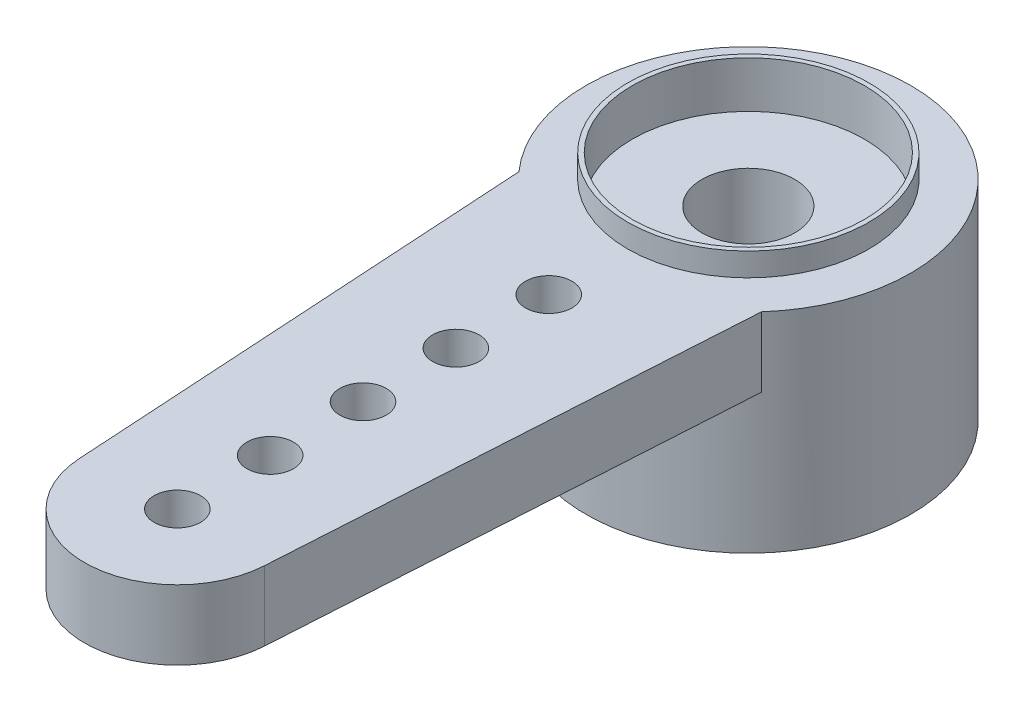
from build123d import *

# Parameters (mm, degrees)
SKETCH1_R           = 0.5
SKETCH1_R_2         = 1
BOSS_EXTRUDE1_DEPTH = 0.75
SKETCH2_R           = 3.5
SKETCH2_R_2         = 2.375
BOSS_EXTRUDE2_DEPTH = 3
SKETCH4_R           = 2.6
SKETCH4_R_2         = 2.5
EXTRUDE_THIN1_DEPTH = 0.5
CUT_EXTRUDE1_START  = -0.5
SKETCH5_R           = 2.5
CUT_EXTRUDE1_DEPTH  = 0.5
MOVE_FACE1_BY       = 0.5


with BuildPart() as part:
    # Sketch1 → Boss-Extrude1 (new, symmetric)
    with BuildSketch(Plane(origin=(0, 0, 0), x_dir=(1, 0, 0), z_dir=(0, 1, 0))):
        with BuildLine():
            Line((-2.612867, -2.328718), (-1.996279, -12.421951))
            ThreePointArc((-1.996279, -12.421951), (0, -14.3), (1.996279, -12.421951))
            Line((1.996279, -12.421951), (2.612867, -2.328718))
            ThreePointArc((2.612867, -2.328718), (0, 3.5), (-2.612867, -2.328718))
        make_face()
        with Locations(Location((0, -12.3, 0), (0, 0, 270))):
            Circle(SKETCH1_R, mode=Mode.SUBTRACT)
        with Locations(Location((0, -10.3, 0), (0, 0, 270))):
            Circle(SKETCH1_R, mode=Mode.SUBTRACT)
        with Locations(Location((0, -8.3, 0), (0, 0, 270))):
            Circle(SKETCH1_R, mode=Mode.SUBTRACT)
        with Locations(Location((0, -6.3, 0), (0, 0, 270))):
            Circle(SKETCH1_R, mode=Mode.SUBTRACT)
        with Locations(Location((0, -4.3, 0), (0, 0, 270))):
            Circle(SKETCH1_R, mode=Mode.SUBTRACT)
        with Locations(Location((0, 0, 0), (0, 0, 270))):
            Circle(SKETCH1_R_2, mode=Mode.SUBTRACT)
    extrude(amount=BOSS_EXTRUDE1_DEPTH, both=True)

    # Sketch2 → Boss-Extrude2 (add)
    with BuildSketch(Plane.XZ.offset(0.75)):
        with Locations(Location((0, 0, 0), (0, 0, 270))):
            Circle(SKETCH2_R)
        with Locations(Location((0, 0, 0), (0, 0, 270))):
            Circle(SKETCH2_R_2, mode=Mode.SUBTRACT)
    extrude(amount=BOSS_EXTRUDE2_DEPTH)

    # Sketch4 → Extrude-Thin1 (add)
    with BuildSketch(Plane(origin=(0, 0.75, 0), x_dir=(1, 0, 0), z_dir=(0, 1, 0))):
        Circle(SKETCH4_R)
        Circle(SKETCH4_R_2, mode=Mode.SUBTRACT)
    extrude(amount=EXTRUDE_THIN1_DEPTH)

    # Sketch5 → Cut-Extrude1 (cut)
    with BuildSketch(Plane(origin=(0, 0.75, 0), x_dir=(1, 0, 0), z_dir=(0, 1, 0)).offset(CUT_EXTRUDE1_START)):
        Circle(SKETCH5_R)
    extrude(amount=CUT_EXTRUDE1_DEPTH, mode=Mode.SUBTRACT)

    # Move Face1: a face moved outward by 0.5
    extrude(part.faces().sort_by_distance((0, -0.75, 1.1875))[0], amount=MOVE_FACE1_BY, dir=(0, -1, 0))


solid = part.part
